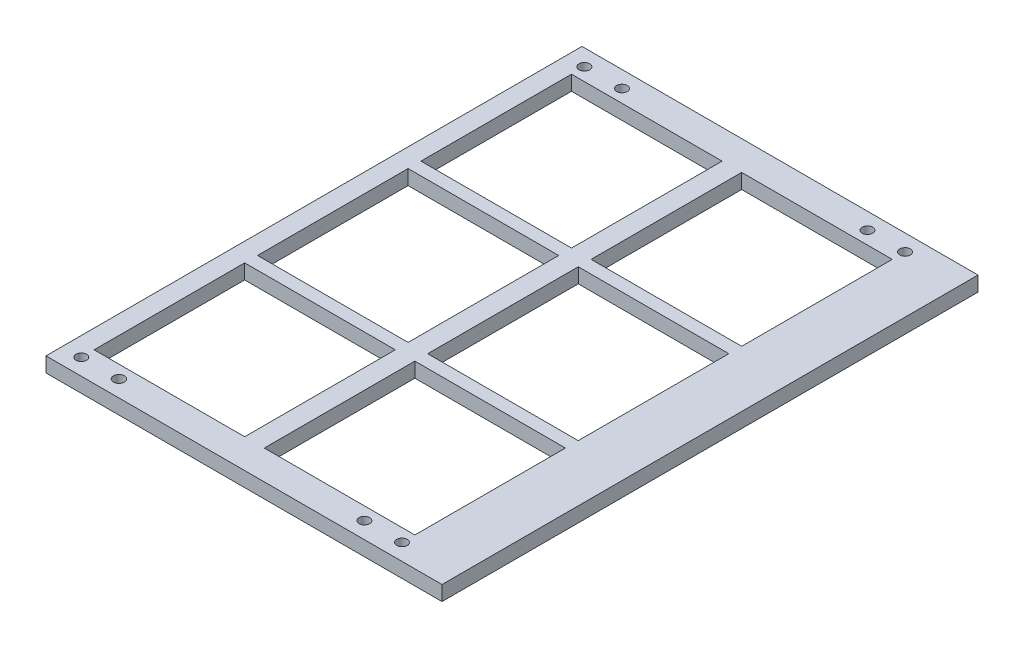
from build123d import *

# Parameters (mm, degrees)
SKETCH1_W                 = 267.22
SKETCH1_H                 = 361.68
SKETCH1_R                 = 3.57
SKETCH1_R_2               = 3.7
BOSS_EXTRUDE1_DEPTH       = 10
SKETCH2_W                 = 101.6
SKETCH2_H                 = 101.6
CUT_EXTRUDE1_DEPTH        = 226.066074076
LPATTERN1_COUNT           = 2
LPATTERN1_PITCH           = 110.265
LPATTERN2_COUNT           = 2
LPATTERN2_PITCH           = 110.265
LPATTERN3_COUNT           = 2
LPATTERN3_PITCH           = 114.82
LPATTERN3_COPY_1_SKETCH_W = 101.6
LPATTERN3_COPY_1_SKETCH_H = 101.6
LPATTERN3_COPY_1_DEPTH    = 226.066074076
LPATTERN3_COPY_2_SKETCH_W = 101.6
LPATTERN3_COPY_2_SKETCH_H = 101.6
LPATTERN3_COPY_2_DEPTH    = 226.066074076


with BuildPart() as part:
    # Sketch1 → Boss-Extrude1 (new body)
    with BuildSketch(Plane(origin=(0, 0, 0), x_dir=(1, 0, 0), z_dir=(0, 1, 0))):
        Rectangle(SKETCH1_W, SKETCH1_H)
        with Locations(Location((-120.91, -169.7275, 0), (0, 0, 270))):
            Circle(SKETCH1_R, mode=Mode.SUBTRACT)
        with Locations(Location((-120.91, 169.7275, 0), (0, 0, 270))):
            Circle(SKETCH1_R, mode=Mode.SUBTRACT)
        with Locations(Location((70.11, 169.7275, 0), (0, 0, 270))):
            Circle(SKETCH1_R, mode=Mode.SUBTRACT)
        with Locations(Location((70.11, -169.7275, 0), (0, 0, 270))):
            Circle(SKETCH1_R, mode=Mode.SUBTRACT)
        with Locations(Location((-95.51, 169.7275, 0), (0, 0, 270))):
            Circle(SKETCH1_R, mode=Mode.SUBTRACT)
        with Locations(Location((-95.51, -169.7275, 0), (0, 0, 270))):
            Circle(SKETCH1_R_2, mode=Mode.SUBTRACT)
        with Locations(Location((95.51, 169.7275, 0), (0, 0, 270))):
            Circle(SKETCH1_R, mode=Mode.SUBTRACT)
        with Locations(Location((95.51, -169.7275, 0), (0, 0, 270))):
            Circle(SKETCH1_R, mode=Mode.SUBTRACT)
    extrude(amount=BOSS_EXTRUDE1_DEPTH)

    # Sketch2 → Cut-Extrude1 (cut, through all)
    with BuildSketch(Plane(origin=(0, 10, 0), x_dir=(1, 0, 0), z_dir=(0, 1, 0))):
        with Locations((-70.11, 0)):
            Rectangle(SKETCH2_W, SKETCH2_H)
    cut_extrude1 = extrude(amount=-CUT_EXTRUDE1_DEPTH, mode=Mode.SUBTRACT)

    # LPattern1: Cut-Extrude1 ×2
    with Locations(*[(0, 0, -i * LPATTERN1_PITCH) for i in range(1, LPATTERN1_COUNT)]):
        add(cut_extrude1, mode=Mode.SUBTRACT)

    # LPattern2: Cut-Extrude1 ×2
    with Locations(*[(0, 0, i * LPATTERN2_PITCH) for i in range(1, LPATTERN2_COUNT)]):
        add(cut_extrude1, mode=Mode.SUBTRACT)

    # LPattern3: Cut-Extrude1 ×2
    with Locations(*[(i * LPATTERN3_PITCH, 0, 0) for i in range(1, LPATTERN3_COUNT)]):
        add(cut_extrude1, mode=Mode.SUBTRACT)

    # LPattern3 copy 1 sketch → LPattern3 copy 1 (cut, through all)
    with BuildSketch(Plane(origin=(114.82, 10, -110.265), x_dir=(1, 0, 0), z_dir=(0, 1, 0))):
        with Locations((-70.11, 0)):
            Rectangle(LPATTERN3_COPY_1_SKETCH_W, LPATTERN3_COPY_1_SKETCH_H)
    extrude(amount=-LPATTERN3_COPY_1_DEPTH, mode=Mode.SUBTRACT)

    # LPattern3 copy 2 sketch → LPattern3 copy 2 (cut, through all)
    with BuildSketch(Plane(origin=(114.82, 10, 110.265), x_dir=(1, 0, 0), z_dir=(0, 1, 0))):
        with Locations((-70.11, 0)):
            Rectangle(LPATTERN3_COPY_2_SKETCH_W, LPATTERN3_COPY_2_SKETCH_H)
    extrude(amount=-LPATTERN3_COPY_2_DEPTH, mode=Mode.SUBTRACT)


solid = part.part
